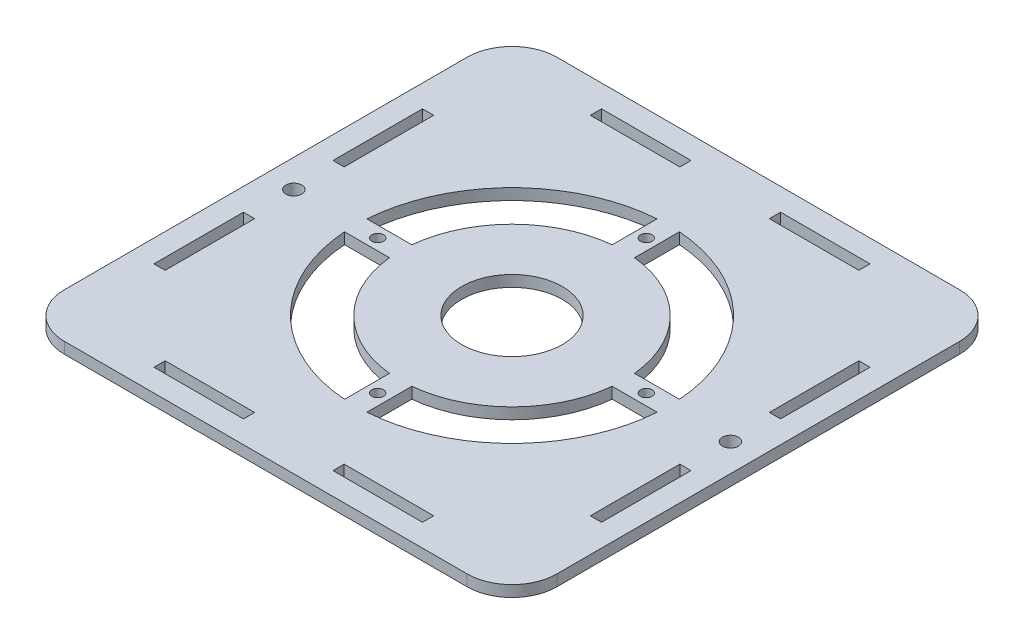
from build123d import *

# Parameters (mm, degrees)
SKETCH1_W                 = 139.7
SKETCH1_H                 = 139.7
BOSS_EXTRUDE1_DEPTH       = 3.175
SKETCH13_W                = 25.4
SKETCH13_H                = 3.175
CUT_EXTRUDE6_DEPTH        = 6.35
LPATTERN7_COUNT           = 2
LPATTERN7_PITCH           = 123.825
SKETCH14_W                = 3.175
SKETCH14_H                = 25.4
CUT_EXTRUDE7_DEPTH        = 6.35
F_8_CLEARANCE_HOLE1_D     = 4.4958
F_8_CLEARANCE_HOLE1_DEPTH = 10.16
F_8_CLEARANCE_HOLE1_TIP   = 1.350674586
SKETCH18_R                = 14.2875
CUT_EXTRUDE9_DEPTH        = 7.62
FILLET6_R                 = 12.7
CUT_EXTRUDE17_DEPTH       = 7.62
CIRPATTERN1_COUNT         = 4


with BuildPart() as part:
    # Sketch1 → Boss-Extrude1 (new body)
    with BuildSketch(Plane(origin=(0, 0, 0), x_dir=(1, 0, 0), z_dir=(0, 1, 0))):
        with Locations((69.85, 69.85)):
            Rectangle(SKETCH1_W, SKETCH1_H)
    extrude(amount=BOSS_EXTRUDE1_DEPTH)

    # Sketch13 → Cut-Extrude6 (cut)
    with BuildSketch(Plane(origin=(0, 3.175, 0), x_dir=(1, 0, 0), z_dir=(0, 1, 0))):
        with Locations((44.45, 7.9375)):
            Rectangle(SKETCH13_W, SKETCH13_H)
        with Locations((95.25, 7.9375)):
            Rectangle(SKETCH13_W, SKETCH13_H)
    cut_extrude6 = extrude(amount=-CUT_EXTRUDE6_DEPTH, mode=Mode.SUBTRACT)

    # LPattern7: Cut-Extrude6 ×2
    with Locations(*[(0, 0, -i * LPATTERN7_PITCH) for i in range(1, LPATTERN7_COUNT)]):
        add(cut_extrude6, mode=Mode.SUBTRACT)

    # Sketch14 → Cut-Extrude7 (cut)
    with BuildSketch(Plane(origin=(0, 3.175, 0), x_dir=(1, 0, 0), z_dir=(0, 1, 0))):
        with Locations((7.9375, 44.45)):
            Rectangle(SKETCH14_W, SKETCH14_H)
        with Locations((131.7625, 44.45)):
            Rectangle(SKETCH14_W, SKETCH14_H)
        with Locations((131.7625, 95.25)):
            Rectangle(SKETCH14_W, SKETCH14_H)
        with Locations((7.9375, 95.25)):
            Rectangle(SKETCH14_W, SKETCH14_H)
    extrude(amount=-CUT_EXTRUDE7_DEPTH, mode=Mode.SUBTRACT)

    # #8 Clearance Hole1
    with Locations(Plane(origin=(0, 3.175, 0), x_dir=(1, 0, 0), z_dir=(0, 1, 0))):
        with Locations((7.9375, 69.85), (131.826, 69.85)):
            Hole(F_8_CLEARANCE_HOLE1_D / 2, depth=F_8_CLEARANCE_HOLE1_DEPTH)
            with Locations((0, 0, -(F_8_CLEARANCE_HOLE1_DEPTH + F_8_CLEARANCE_HOLE1_TIP / 2))):  # 118° drill point
                Cone(0, F_8_CLEARANCE_HOLE1_D / 2, F_8_CLEARANCE_HOLE1_TIP, mode=Mode.SUBTRACT)

    # Sketch18 → Cut-Extrude9 (cut)
    with BuildSketch(Plane(origin=(0, 3.175, 0), x_dir=(1, 0, 0), z_dir=(0, 1, 0))):
        with Locations(Location((69.85, 69.85, 0), (0, 0, 270))):
            Circle(SKETCH18_R)
    extrude(amount=-CUT_EXTRUDE9_DEPTH, mode=Mode.SUBTRACT)

    # Fillet6
    fillet6_edges = [part.edges().sort_by_distance(p)[0] for p in [
        (0, 1.5875, -139.7),
        (139.7, 1.5875, -139.7),
        (139.7, 1.5875, 0),
        (0, 1.5875, 0),
    ]]
    fillet(fillet6_edges, radius=FILLET6_R)

    # Sketch26 → Cut-Extrude17 (cut)
    with BuildSketch(Plane(origin=(0, 3.175, 0), x_dir=(1, 0, 0), z_dir=(0, 1, 0))):
        with BuildLine():
            ThreePointArc((66.675, 114.186462139), (38.419103576, 101.280896424), (25.513537861, 73.025))
            Line((25.513537861, 73.025), (38.259148872, 73.025))
            ThreePointArc((38.259148872, 73.025), (47.399359697, 92.300640303), (66.675, 101.440851128))
            Line((66.675, 101.440851128), (66.675, 114.186462139))
        make_face()
        with BuildLine():
            ThreePointArc((25.513537861, 66.675), (38.419103576, 38.419103576), (66.675, 25.513537861))
            Line((66.675, 25.513537861), (66.675, 38.259148872))
            ThreePointArc((66.675, 38.259148872), (47.399359697, 47.399359697), (38.259148872, 66.675))
            Line((38.259148872, 66.675), (25.513537861, 66.675))
        make_face()
        with BuildLine():
            Line((73.025, 38.259148872), (73.025, 25.513537861))
            ThreePointArc((73.025, 25.513537861), (101.280896424, 38.419103576), (114.186462139, 66.675))
            Line((114.186462139, 66.675), (101.440851128, 66.675))
            ThreePointArc((101.440851128, 66.675), (92.300640303, 47.399359697), (73.025, 38.259148872))
        make_face()
        with BuildLine():
            Line((101.440851128, 73.025), (114.186462139, 73.025))
            ThreePointArc((114.186462139, 73.025), (101.280896424, 101.280896424), (73.025, 114.186462139))
            Line((73.025, 114.186462139), (73.025, 101.440851128))
            ThreePointArc((73.025, 101.440851128), (92.300640303, 92.300640303), (101.440851128, 73.025))
        make_face()
    extrude(amount=-CUT_EXTRUDE17_DEPTH, mode=Mode.SUBTRACT)

    # Sketch27 → #4 Clearance Hole1 (revolve, cut)
    with BuildSketch(Plane(origin=(69.85, 3.175, -107.95), x_dir=(0, 0, 1), z_dir=(1, 0, 0))):
        Polygon((0, 0), (0, 11.140574487), (1.63195, 10.16), (1.63195, 0), align=None)
    f_4_clearance_hole1 = revolve(axis=Axis((69.85, 9.525, -107.95), (0, -1, 0)), mode=Mode.SUBTRACT)

    # CirPattern1: #4 Clearance Hole1 ×4 about axis
    cirpattern1_axis = Axis((69.85, 0, -69.85), (0, 1, 0))
    for i in range(1, CIRPATTERN1_COUNT):
        add(f_4_clearance_hole1.rotate(cirpattern1_axis, i * 360 / CIRPATTERN1_COUNT), mode=Mode.SUBTRACT)


solid = part.part
